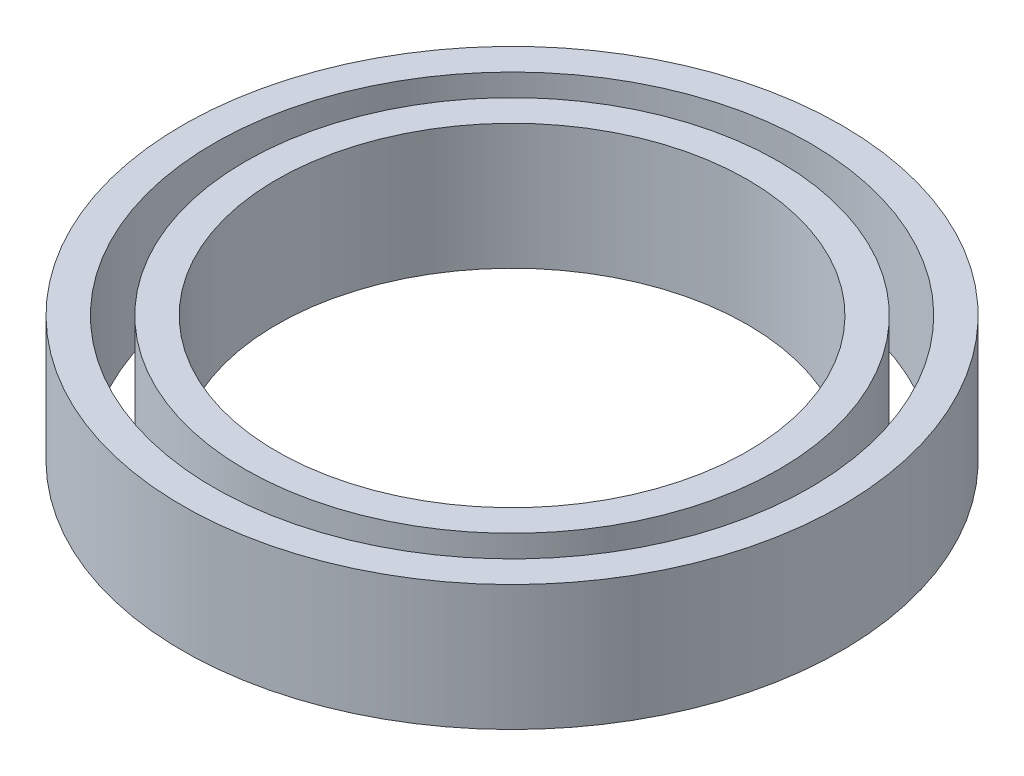
from build123d import *

# Parameters (mm, degrees)
ESQUISSE2_W = 1
ESQUISSE2_H = 4


with BuildPart() as part:
    # Esquisse2 → Révolution1 (revolve)
    with BuildSketch(Plane.XY, mode=Mode.PRIVATE) as r_volution1_sk:
        with Locations((8, 2)):
            Rectangle(ESQUISSE2_W, ESQUISSE2_H)
        with Locations((10, 2)):
            Rectangle(ESQUISSE2_W, ESQUISSE2_H)
    revolve(r_volution1_sk.sketch.rotate(Axis((0, 0, 0), (0, 1, 0)), 90), axis=Axis((0, 0, 0), (0, 1, 0)))


solid = part.part
